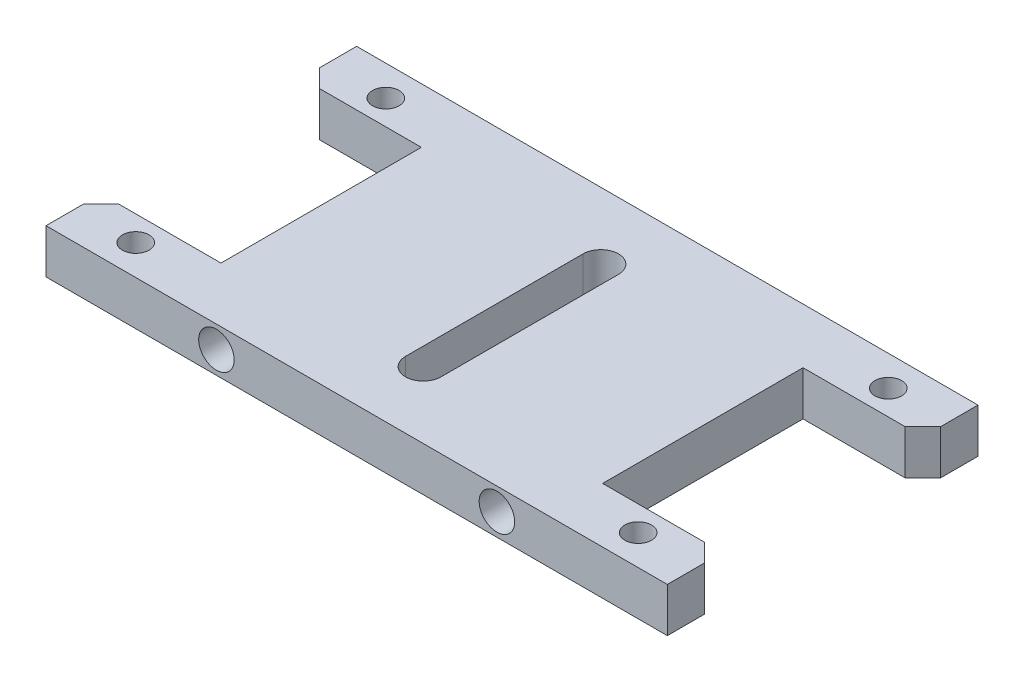
from build123d import *

# Parameters (mm, degrees)
SKETCH_1_R          = 1.5
EXTRUDE_1_DEPTH     = 5
CHAMFER_1_SIZE      = 2
SKETCH_2_R          = 2
CUT_EXTRUDE_1_DEPTH = 50.749371855


with BuildPart() as part:
    # 草图1 → 凸台-拉伸1 (new body)
    with BuildSketch(Plane(origin=(0, 0, 0), x_dir=(1, 0, 0), z_dir=(0, 1, 0))):
        Polygon((35, 17.5), (-35, 17.5), (-35, 11.288596674), (-21.49999999, 11.288596674), (-21.49999999, -11.288596674), (-35, -11.288596674), (-35, -17.5), (35, -17.5), (35, -11.288596674), (21.49999999, -11.288596674), (21.49999999, 11.288596674), (35, 11.288596674), align=None)
        with Locations(Location((-28.303727501, -14.088596674, 0), (0, 0, 270))):
            Circle(SKETCH_1_R, mode=Mode.SUBTRACT)
        with Locations(Location((28.303727501, -14.088596674, 0), (0, 0, 270))):
            Circle(SKETCH_1_R, mode=Mode.SUBTRACT)
        with BuildLine():
            ThreePointArc((-2, 10), (0, 12), (2, 10))
            Line((2, 10), (2, -10))
            ThreePointArc((2, -10), (0, -12), (-2, -10))
            Line((-2, -10), (-2, 10))
        make_face(mode=Mode.SUBTRACT)
        with Locations(Location((-28.303727501, 14.088596674, 0), (0, 0, 270))):
            Circle(SKETCH_1_R, mode=Mode.SUBTRACT)
        with Locations(Location((28.303727501, 14.088596674, 0), (0, 0, 270))):
            Circle(SKETCH_1_R, mode=Mode.SUBTRACT)
    extrude(amount=EXTRUDE_1_DEPTH)

    # 倒角1
    chamfer_1_edges = [part.edges().sort_by_distance(p)[0] for p in [
        (35, 2.5, 11.288596674),
        (-35, 2.5, 11.288596674),
        (-35, 2.5, -11.288596674),
        (35, 2.5, -11.288596674),
    ]]
    chamfer(chamfer_1_edges, length=CHAMFER_1_SIZE)

    # 草图2 → 切除-拉伸1 (cut, through all)
    with BuildSketch(Plane.XY.offset(17.5)):
        with Locations((-15.8, 2.5)):
            Circle(SKETCH_2_R)
        with Locations(Location((15.8, 2.5, 0), (0, 0, 180))):
            Circle(SKETCH_2_R)
    extrude(amount=-CUT_EXTRUDE_1_DEPTH, mode=Mode.SUBTRACT)


solid = part.part
